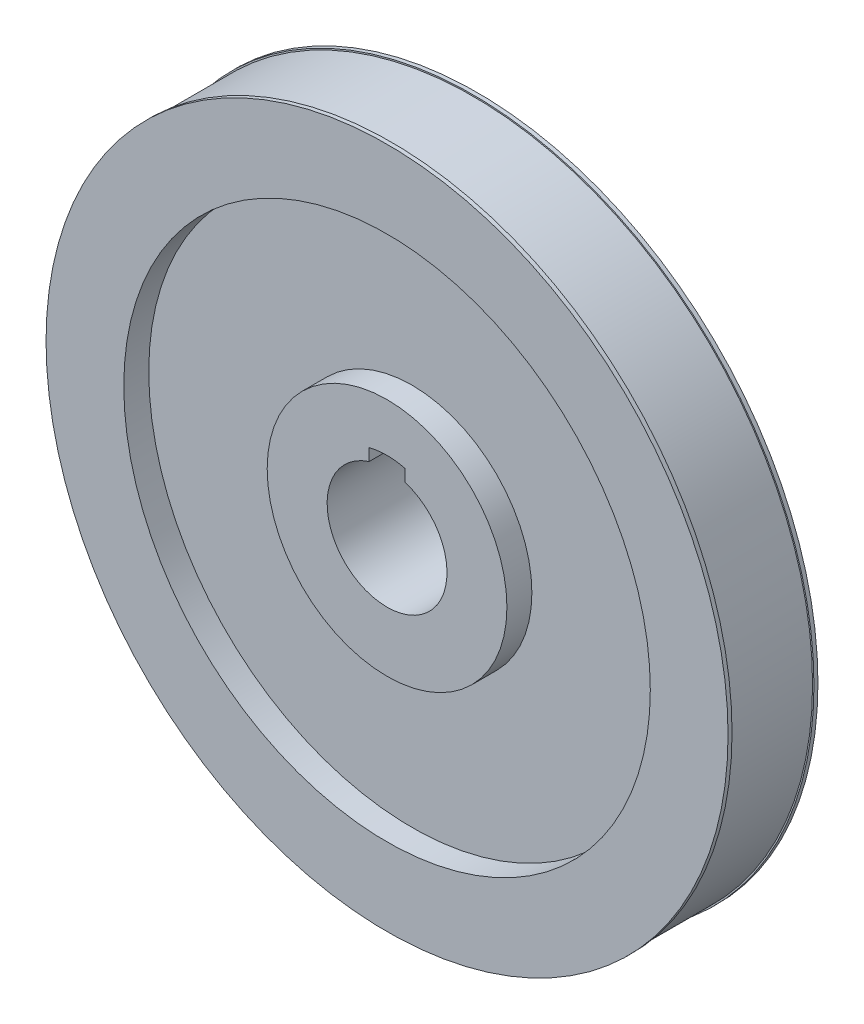
from build123d import *

# Parameters (mm, degrees)
SKETCH1_R           = 170
BOSS_EXTRUDE1_DEPTH = 22.5
SKETCH2_R           = 170.69
BOSS_EXTRUDE2_DEPTH = 2
CUT_EXTRUDE3_START  = 10
SKETCH5_R           = 131.78
SKETCH5_R_2         = 60
CUT_EXTRUDE3_DEPTH  = 233.438450333
SKETCH6_R           = 30
CUT_EXTRUDE4_DEPTH  = 246.550712074
CUT_EXTRUDE5_DEPTH  = 246.550712074


with BuildPart() as part:
    # Sketch1 → Boss-Extrude1 (new, symmetric)
    with BuildSketch(Plane.XY):
        with Locations(Location((0, 0, 0), (0, 0, 180))):
            Circle(SKETCH1_R)
    extrude(amount=BOSS_EXTRUDE1_DEPTH, both=True)

    # Sketch2 → Boss-Extrude2 (add)
    with BuildSketch(Plane.XY.offset(22.5)):
        Circle(SKETCH2_R)
    boss_extrude2 = extrude(amount=-BOSS_EXTRUDE2_DEPTH)

    # Mirror1: Boss-Extrude2 across plane
    add(boss_extrude2.mirror(Plane.XY))

    # Sketch5 → Cut-Extrude3 (cut, through all)
    with BuildSketch(Plane.XY.offset(CUT_EXTRUDE3_START)):
        with Locations(Location((0, 0, 0), (0, 0, 180))):
            Circle(SKETCH5_R)
        with Locations(Location((0, 0, 0), (0, 0, 180))):
            Circle(SKETCH5_R_2, mode=Mode.SUBTRACT)
    cut_extrude3 = extrude(amount=CUT_EXTRUDE3_DEPTH, mode=Mode.SUBTRACT)

    # Mirror2: Cut-Extrude3 across plane
    add(cut_extrude3.mirror(Plane.XY), mode=Mode.SUBTRACT)

    # Sketch6 → Cut-Extrude4 (cut, through all)
    with BuildSketch(Plane.XY.offset(22.5)):
        Circle(SKETCH6_R)
    extrude(amount=-CUT_EXTRUDE4_DEPTH, mode=Mode.SUBTRACT)

    # Sketch7 → Cut-Extrude5 (cut, through all)
    with BuildSketch(Plane.XY.offset(22.5)):
        with BuildLine():
            Line((9, 20.2728873), (9, 34.650252524))
            ThreePointArc((9, 34.650252524), (0, 35.8), (-9, 34.650252524))
            Line((-9, 34.650252524), (-9, 20.2728873))
            Line((-9, 20.2728873), (9, 20.2728873))
        make_face()
    extrude(amount=-CUT_EXTRUDE5_DEPTH, mode=Mode.SUBTRACT)


solid = part.part
